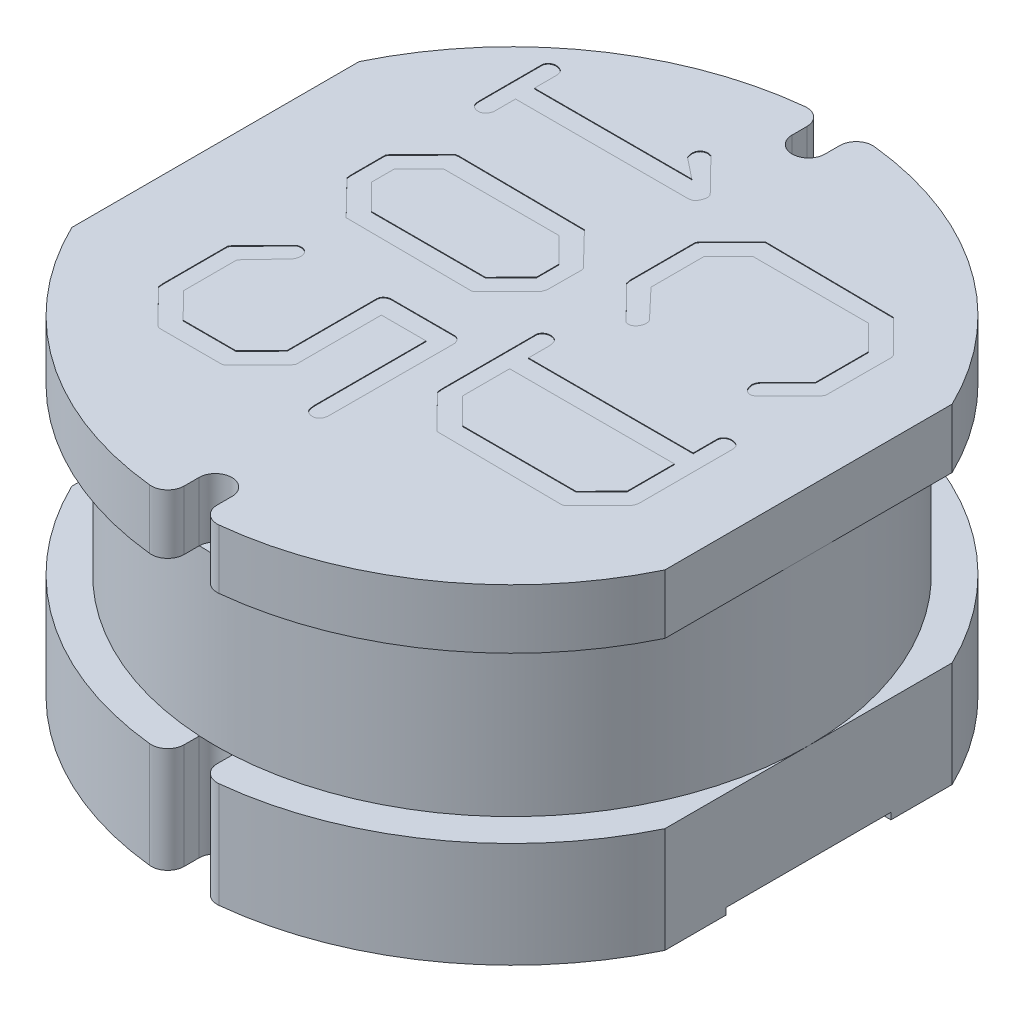
from build123d import *

# Parameters (mm, degrees)
BOSS_EXTRUDE1_DEPTH = 1.5
SKETCH2_R           = 4.5
BOSS_EXTRUDE2_DEPTH = 2.5
BOSS_EXTRUDE3_DEPTH = 0.9
BOSS_EXTRUDE4_START = 0.1
BOSS_EXTRUDE4_DEPTH = 0.1
CUT_EXTRUDE1_DEPTH  = 0.01


with BuildPart() as part:
    # Sketch1 → Boss-Extrude1 (new body)
    with BuildSketch(Plane(origin=(0, 0, 0), x_dir=(1, 0, 0), z_dir=(0, 1, 0))):
        with BuildLine():
            Line((-4.5, 2.179449472), (-4.5, -2.179449472))
            ThreePointArc((-4.5, -2.179449472), (-2.875040385, -4.09073866), (-0.526315789, -4.972222007))
            ThreePointArc((-0.526315789, -4.972222007), (-0.332785986, -4.909458892), (-0.25, -4.723610907))
            Line((-0.25, -4.723610907), (-0.25, -4.5))
            ThreePointArc((-0.25, -4.5), (0, -4.25), (0.25, -4.5))
            Line((0.25, -4.5), (0.25, -4.723610907))
            ThreePointArc((0.25, -4.723610907), (0.332785986, -4.909458892), (0.526315789, -4.972222007))
            ThreePointArc((0.526315789, -4.972222007), (2.875040385, -4.09073866), (4.5, -2.179449472))
            Line((4.5, -2.179449472), (4.5, 2.179449472))
            ThreePointArc((4.5, 2.179449472), (2.875040385, 4.09073866), (0.526315789, 4.972222007))
            ThreePointArc((0.526315789, 4.972222007), (0.332785986, 4.909458892), (0.25, 4.723610907))
            Line((0.25, 4.723610907), (0.25, 4.5))
            ThreePointArc((0.25, 4.5), (0, 4.25), (-0.25, 4.5))
            Line((-0.25, 4.5), (-0.25, 4.723610907))
            ThreePointArc((-0.25, 4.723610907), (-0.332785986, 4.909458892), (-0.526315789, 4.972222007))
            ThreePointArc((-0.526315789, 4.972222007), (-2.875040385, 4.09073866), (-4.5, 2.179449472))
        make_face()
    extrude(amount=BOSS_EXTRUDE1_DEPTH)

    # Sketch2 → Boss-Extrude2 (add)
    with BuildSketch(Plane(origin=(0, 1.5, 0), x_dir=(1, 0, 0), z_dir=(0, 1, 0))):
        with Locations(Location((0, 0, 0), (0, 0, 86.816491647))):
            Circle(SKETCH2_R)
    extrude(amount=BOSS_EXTRUDE2_DEPTH)

    # Sketch3 → Boss-Extrude3 (add)
    with BuildSketch(Plane(origin=(0, 4, 0), x_dir=(1, 0, 0), z_dir=(0, 1, 0))):
        with BuildLine():
            Line((-4.5, 2.179449472), (-4.5, -2.179449472))
            ThreePointArc((-4.5, -2.179449472), (-2.875040385, -4.09073866), (-0.526315789, -4.972222007))
            ThreePointArc((-0.526315789, -4.972222007), (-0.332785986, -4.909458892), (-0.25, -4.723610907))
            Line((-0.25, -4.723610907), (-0.25, -4.5))
            ThreePointArc((-0.25, -4.5), (0, -4.25), (0.25, -4.5))
            Line((0.25, -4.5), (0.25, -4.723610907))
            ThreePointArc((0.25, -4.723610907), (0.332785986, -4.909458892), (0.526315789, -4.972222007))
            ThreePointArc((0.526315789, -4.972222007), (2.875040385, -4.09073866), (4.5, -2.179449472))
            Line((4.5, -2.179449472), (4.5, 2.179449472))
            ThreePointArc((4.5, 2.179449472), (2.875040385, 4.09073866), (0.526315789, 4.972222007))
            ThreePointArc((0.526315789, 4.972222007), (0.332785986, 4.909458892), (0.25, 4.723610907))
            Line((0.25, 4.723610907), (0.25, 4.5))
            ThreePointArc((0.25, 4.5), (0, 4.25), (-0.25, 4.5))
            Line((-0.25, 4.5), (-0.25, 4.723610907))
            ThreePointArc((-0.25, 4.723610907), (-0.332785986, 4.909458892), (-0.526315789, 4.972222007))
            ThreePointArc((-0.526315789, 4.972222007), (-2.875040385, 4.09073866), (-4.5, 2.179449472))
        make_face()
    extrude(amount=BOSS_EXTRUDE3_DEPTH)

    # Sketch4 → Boss-Extrude4 (add)
    with BuildSketch(Plane.XZ.offset(BOSS_EXTRUDE4_START)):
        with BuildLine():
            Line((-4.5, 2.179449472), (-4.5, 1.25))
            Line((-4.5, 1.25), (4.5, 1.25))
            Line((4.5, 1.25), (4.5, 2.179449472))
            ThreePointArc((4.5, 2.179449472), (2.875040385, 4.09073866), (0.526315789, 4.972222007))
            ThreePointArc((0.526315789, 4.972222007), (0.332785986, 4.909458892), (0.25, 4.723610907))
            Line((0.25, 4.723610907), (0.25, 4.5))
            ThreePointArc((0.25, 4.5), (0, 4.25), (-0.25, 4.5))
            Line((-0.25, 4.5), (-0.25, 4.723610907))
            ThreePointArc((-0.25, 4.723610907), (-0.332785986, 4.909458892), (-0.526315789, 4.972222007))
            ThreePointArc((-0.526315789, 4.972222007), (-2.875040385, 4.09073866), (-4.5, 2.179449472))
        make_face()
        with BuildLine():
            Line((4.5, -1.25), (-4.5, -1.25))
            Line((-4.5, -1.25), (-4.5, -2.179449472))
            ThreePointArc((-4.5, -2.179449472), (-2.875040385, -4.09073866), (-0.526315789, -4.972222007))
            ThreePointArc((-0.526315789, -4.972222007), (-0.332785986, -4.909458892), (-0.25, -4.723610907))
            Line((-0.25, -4.723610907), (-0.25, -4.5))
            ThreePointArc((-0.25, -4.5), (0, -4.25), (0.25, -4.5))
            Line((0.25, -4.5), (0.25, -4.723610907))
            ThreePointArc((0.25, -4.723610907), (0.332785986, -4.909458892), (0.526315789, -4.972222007))
            ThreePointArc((0.526315789, -4.972222007), (2.875040385, -4.09073866), (4.5, -2.179449472))
            Line((4.5, -2.179449472), (4.5, -1.25))
        make_face()
    extrude(amount=-BOSS_EXTRUDE4_DEPTH)

    # Sketch6 → Cut-Extrude1 (cut)
    # profile 1 of 5: a face of its own
    with BuildSketch(Plane(origin=(0, 4.9, 0), x_dir=(1, 0, 0), z_dir=(0, 1, 0))):
        with BuildLine():
            Line((3.383928571, 1.272321429), (2.898995536, 0.791852679))
            add(Edge.make_bspline(
                [(2.898995536, 0.791852679), (2.888514153, 0.78545163), (2.871258821, 0.774913688), (2.851504845, 0.77104858), (2.84375, 0.76953125)],
                knots=[0, 0, 0, 0, 1.214857265, 2, 2, 2, 2], degree=3))
            add(Edge.make_bspline(
                [(2.84375, 0.76953125), (2.835284508, 0.770652848), (2.820551639, 0.772604815), (2.806681584, 0.777886917), (2.80078125, 0.780133929)],
                knots=[0, 0, 0, 0, 1.149198132, 2, 2, 2, 2], degree=3))
            add(Edge.make_bspline(
                [(2.80078125, 0.780133929), (2.790924001, 0.785429895), (2.770273529, 0.796524694), (2.748737055, 0.828434164), (2.732397969, 0.869235331), (2.727194865, 0.900665331), (2.724330357, 0.91796875)],
                knots=[0, 0, 0, 0, 0.804928788, 1.686287835, 2.726212839, 4, 4, 4, 4], degree=3))
            add(Edge.make_bspline(
                [(2.724330357, 0.91796875), (2.726022041, 0.927928799), (2.729246374, 0.946912559), (2.739344446, 0.972386231), (2.749866091, 0.995236009), (2.760480098, 1.007089236), (2.765625, 1.012834821)],
                knots=[0, 0, 0, 0, 1.150280358, 2.192423643, 3.123817944, 4, 4, 4, 4], degree=3))
            Line((2.765625, 1.012834821), (3.178571429, 1.430803571))
            Line((3.178571429, 1.430803571), (3.178571429, 2.229352679))
            Line((3.178571429, 2.229352679), (2.800223214, 2.607142857))
            Line((2.800223214, 2.607142857), (1.052455357, 2.607142857))
            Line((1.052455357, 2.607142857), (0.678571429, 2.229910714))
            Line((0.678571429, 2.229910714), (0.678571429, 1.430803571))
            Line((0.678571429, 1.430803571), (1.098772321, 0.987165179))
            add(Edge.make_bspline(
                [(1.098772321, 0.987165179), (1.104399509, 0.977553346), (1.115809958, 0.958063089), (1.117464822, 0.935528536), (1.118303571, 0.924107143)],
                knots=[0, 0, 0, 0, 0.986321751, 2, 2, 2, 2], degree=3))
            add(Edge.make_bspline(
                [(1.118303571, 0.924107143), (1.117960176, 0.91382715), (1.117295075, 0.893916435), (1.109607101, 0.865156823), (1.097200549, 0.838792972), (1.080625639, 0.814973645), (1.061127713, 0.795323186), (1.039739113, 0.780474656), (1.016664519, 0.771651881), (1.000627135, 0.770978336), (0.992745536, 0.770647321)],
                knots=[0, 0, 0, 0, 1.123847078, 2.176713554, 3.234303193, 4.302832359, 5.340400216, 6.250442534, 7.140177092, 8, 8, 8, 8], degree=3))
            Line((0.992745536, 0.770647321), (0.952008929, 0.779575893))
            Line((0.952008929, 0.779575893), (0.444196429, 1.294084821))
            Line((0.444196429, 1.294084821), (0.428571429, 1.359375))
            Line((0.428571429, 1.359375), (0.428571429, 2.356026786))
            Line((0.428571429, 2.356026786), (0.452566964, 2.392857143))
            Line((0.452566964, 2.392857143), (0.953125, 2.892857143))
            Line((0.953125, 2.892857143), (1.008928571, 2.892857143))
            Line((1.008928571, 2.892857143), (2.918526786, 2.872767857))
            Line((2.918526786, 2.872767857), (3.415736607, 2.369419643))
            Line((3.415736607, 2.369419643), (3.428571429, 2.330915179))
            Line((3.428571429, 2.330915179), (3.424665179, 1.328683036))
            Line((3.424665179, 1.328683036), (3.383928571, 1.272321429))
        make_face()
    # profile 2 of 5: a face of its own
    with BuildSketch(Plane(origin=(0, 4.9, 0), x_dir=(1, 0, 0), z_dir=(0, 1, 0))):
        with BuildLine():
            Line((3.377790179, -1.606584821), (2.890066964, -2.09765625))
            Line((2.890066964, -2.09765625), (2.849888393, -2.106026786))
            Line((2.849888393, -2.106026786), (0.948102679, -2.08984375))
            Line((0.948102679, -2.08984375), (0.435825893, -1.56640625))
            Line((0.435825893, -1.56640625), (0.428571429, -1.488839286))
            Line((0.428571429, -1.488839286), (0.428571429, -0.044642857))
            add(Edge.make_bspline(
                [(0.428571429, -0.044642857), (0.43452747, -0.032417302), (0.445944412, -0.008982535), (0.475170827, 0.017661126), (0.512169861, 0.033334688), (0.539273381, 0.034892491), (0.553571429, 0.035714286)],
                knots=[0, 0, 0, 0, 1.021395482, 1.95787967, 2.922710675, 4, 4, 4, 4], degree=3))
            add(Edge.make_bspline(
                [(0.553571429, 0.035714286), (0.562741579, 0.035371065), (0.580469571, 0.03470754), (0.605388228, 0.027193852), (0.627424261, 0.015199396), (0.646008845, -0.00179421), (0.661166972, -0.023999528), (0.671405341, -0.051725341), (0.677388065, -0.084753331), (0.678158625, -0.108416774), (0.678571429, -0.12109375)],
                knots=[0, 0, 0, 0, 0.962075719, 1.859911645, 2.709535321, 3.582282233, 4.48331142, 5.511760434, 6.667000706, 8, 8, 8, 8], degree=3))
            Line((0.678571429, -0.12109375), (0.678571429, -0.428571429))
            Line((0.678571429, -0.428571429), (3.178571429, -0.428571429))
            Line((3.178571429, -0.428571429), (3.178571429, -0.053571429))
            add(Edge.make_bspline(
                [(3.178571429, -0.053571429), (3.182418223, -0.041442513), (3.189847776, -0.018017184), (3.214251038, 0.00997385), (3.247024769, 0.028990726), (3.272241064, 0.033372876), (3.285714286, 0.035714286)],
                knots=[0, 0, 0, 0, 1.013349928, 1.957145876, 2.908490424, 4, 4, 4, 4], degree=3))
            add(Edge.make_bspline(
                [(3.285714286, 0.035714286), (3.295413488, 0.035427189), (3.314206698, 0.034870908), (3.340987229, 0.029646461), (3.365620931, 0.021975812), (3.387664873, 0.010441668), (3.406523229, -0.006351677), (3.420454379, -0.029686702), (3.42686022, -0.05957514), (3.427973465, -0.081081877), (3.428571429, -0.092633929)],
                knots=[0, 0, 0, 0, 1.05205527, 2.038466143, 2.951864688, 3.846535277, 4.718809578, 5.661009588, 6.743643115, 8, 8, 8, 8], degree=3))
            Line((3.428571429, -0.092633929), (3.428571429, -0.137276786))
            Line((3.428571429, -0.137276786), (3.428571429, -1.475446429))
            add(Edge.make_bspline(
                [(3.428571429, -1.475446429), (3.427969434, -1.489279219), (3.426830502, -1.515449874), (3.417329547, -1.551748326), (3.401611403, -1.583073377), (3.385709396, -1.598768589), (3.377790179, -1.606584821)],
                knots=[0, 0, 0, 0, 1.142777393, 2.162053479, 3.084700629, 4, 4, 4, 4], degree=3))
        make_face()
        Polygon((2.792410714, -1.821428571), (3.178571429, -1.431361607), (3.178571429, -0.714285714), (0.678571429, -0.714285714), (0.678571429, -1.431919643), (1.068080357, -1.821428571), align=None, mode=Mode.SUBTRACT)
    # profile 3 of 5: a face of its own
    with BuildSketch(Plane(origin=(0, 4.9, 0), x_dir=(1, 0, 0), z_dir=(0, 1, 0))):
        with BuildLine():
            Line((-0.151785714, 2.885044643), (-0.203683036, 2.875))
            Line((-0.203683036, 2.875), (-2.821428571, 2.875))
            Line((-2.821428571, 2.875), (-2.821428571, 2.535714286))
            add(Edge.make_bspline(
                [(-2.821428571, 2.535714286), (-2.827521971, 2.521076352), (-2.838834267, 2.493901269), (-2.863633501, 2.460098684), (-2.894322522, 2.437126555), (-2.917665497, 2.431389133), (-2.929129464, 2.428571429)],
                knots=[0, 0, 0, 0, 1.189008233, 2.207374185, 3.119623671, 4, 4, 4, 4], degree=3))
            add(Edge.make_bspline(
                [(-2.929129464, 2.428571429), (-2.946019282, 2.429897037), (-2.980059151, 2.432568678), (-3.020879991, 2.449945031), (-3.048366807, 2.475689104), (-3.062362413, 2.506338406), (-3.070242274, 2.545903905), (-3.071006445, 2.575286813), (-3.071428571, 2.591517857)],
                knots=[0, 0, 0, 0, 1.216892479, 2.452534526, 3.106512186, 3.885698948, 4.832065435, 6, 6, 6, 6], degree=3))
            Line((-3.071428571, 2.591517857), (-3.071428571, 3.540736607))
            add(Edge.make_bspline(
                [(-3.071428571, 3.540736607), (-3.066662291, 3.552070645), (-3.05748244, 3.573899986), (-3.033424728, 3.600429498), (-3.001811813, 3.617544361), (-2.978240256, 3.622446209), (-2.965959821, 3.625)],
                knots=[0, 0, 0, 0, 1.028909836, 1.981678895, 2.948484413, 4, 4, 4, 4], degree=3))
            add(Edge.make_bspline(
                [(-2.965959821, 3.625), (-2.955528513, 3.6244854), (-2.935440966, 3.623494436), (-2.906755105, 3.618392721), (-2.881697852, 3.607977944), (-2.859575362, 3.593981607), (-2.84112815, 3.573402603), (-2.829270353, 3.544692108), (-2.82226303, 3.508901636), (-2.821722986, 3.482555212), (-2.821428571, 3.468191964)],
                knots=[0, 0, 0, 0, 1.013777329, 1.952228677, 2.810656312, 3.632009062, 4.476265827, 5.446155599, 6.607723798, 8, 8, 8, 8], degree=3))
            Line((-2.821428571, 3.468191964), (-2.821428571, 3.160714286))
            Line((-2.821428571, 3.160714286), (-0.432477679, 3.160714286))
            Line((-0.432477679, 3.160714286), (-0.752790179, 3.415178571))
            add(Edge.make_bspline(
                [(-0.752790179, 3.415178571), (-0.755378146, 3.425039713), (-0.760107295, 3.443059577), (-0.766780867, 3.467610461), (-0.770085191, 3.487838453), (-0.771254234, 3.499808819), (-0.771763393, 3.505022321)],
                knots=[0, 0, 0, 0, 1.330298006, 2.430934346, 3.316618377, 4, 4, 4, 4], degree=3))
            add(Edge.make_bspline(
                [(-0.771763393, 3.505022321), (-0.771244217, 3.513041408), (-0.770229362, 3.528716636), (-0.764923897, 3.55151739), (-0.754261842, 3.571786267), (-0.740989506, 3.590626286), (-0.723066259, 3.606754835), (-0.69995572, 3.616876357), (-0.673607409, 3.624049052), (-0.654634312, 3.624669575), (-0.64453125, 3.625)],
                knots=[0, 0, 0, 0, 0.976052942, 1.907929565, 2.817615467, 3.739849352, 4.700870998, 5.701729663, 6.776184527, 8, 8, 8, 8], degree=3))
            Line((-0.64453125, 3.625), (-0.595424107, 3.613839286))
            Line((-0.595424107, 3.613839286), (-0.092075893, 3.099888393))
            add(Edge.make_bspline(
                [(-0.092075893, 3.099888393), (-0.085989435, 3.089931503), (-0.07323618, 3.069068342), (-0.072049113, 3.044599294), (-0.071428571, 3.031808036)],
                knots=[0, 0, 0, 0, 0.954494819, 2, 2, 2, 2], degree=3))
            add(Edge.make_bspline(
                [(-0.071428571, 3.031808036), (-0.072654702, 3.020537263), (-0.075600533, 2.99345874), (-0.089653469, 2.960408145), (-0.102605564, 2.930834694), (-0.117167711, 2.912016686), (-0.132475863, 2.89533309), (-0.145404792, 2.88844445), (-0.151785714, 2.885044643)],
                knots=[0, 0, 0, 0, 1.167612732, 2.805240475, 3.683154432, 4.495326171, 5.257385778, 6, 6, 6, 6], degree=3))
        make_face()
    # profile 4 of 5: a face of its own
    with BuildSketch(Plane(origin=(0, 4.9, 0), x_dir=(1, 0, 0), z_dir=(0, 1, 0))):
        Polygon((-0.099330357, 0.538504464), (-0.604352679, 0.029017857), (-0.637834821, 0.017857143), (-2.546875, 0.030133929), (-3.063058036, 0.55859375), (-3.071428571, 0.622209821), (-3.071428571, 1.150111607), (-3.047433036, 1.188058036), (-2.547991071, 1.69140625), (-2.49609375, 1.696428571), (-0.581473214, 1.680245536), (-0.083705357, 1.166852679), (-0.071428571, 1.126674107), (-0.075334821, 0.60546875), align=None)
        Polygon((-0.707589286, 0.303571429), (-0.321428571, 0.693638393), (-0.321428571, 1.031808036), (-0.696428571, 1.410714286), (-2.446986607, 1.410714286), (-2.821428571, 1.032366071), (-2.821428571, 0.693080357), (-2.431919643, 0.303571429), align=None, mode=Mode.SUBTRACT)
    # profile 5 of 5: a face of its own
    with BuildSketch(Plane(origin=(0, 4.9, 0), x_dir=(1, 0, 0), z_dir=(0, 1, 0))):
        with BuildLine():
            add(Edge.make_bspline(
                [(-0.076450893, -2.721540179), (-0.080006714, -2.737501498), (-0.086578364, -2.767000232), (-0.109033509, -2.803838562), (-0.139747215, -2.830000656), (-0.164738026, -2.83578443), (-0.177455357, -2.838727679)],
                knots=[0, 0, 0, 0, 1.174371758, 2.170402149, 3.068953704, 4, 4, 4, 4], degree=3))
            add(Edge.make_bspline(
                [(-0.177455357, -2.838727679), (-0.187161784, -2.838514082), (-0.206044991, -2.838098545), (-0.233054647, -2.831781936), (-0.257700486, -2.821370263), (-0.281153989, -2.80709589), (-0.300898421, -2.782933899), (-0.312586082, -2.747846389), (-0.320188081, -2.703093107), (-0.320987018, -2.669689189), (-0.321428571, -2.651227679)],
                knots=[0, 0, 0, 0, 0.848445739, 1.65059474, 2.409922083, 3.187037106, 4.031721707, 5.078420244, 6.385315948, 8, 8, 8, 8], degree=3))
            Line((-0.321428571, -2.651227679), (-0.321428571, -0.982142857))
            Line((-0.321428571, -0.982142857), (-1, -0.982142857))
            Line((-1, -0.982142857), (-1, -2.272321429))
            Line((-1, -2.272321429), (-1.034040179, -2.33203125))
            Line((-1.034040179, -2.33203125), (-1.534040179, -2.829799107))
            Line((-1.534040179, -2.829799107), (-1.578125, -2.839285714))
            Line((-1.578125, -2.839285714), (-2.516741071, -2.839285714))
            Line((-2.516741071, -2.839285714), (-2.553571429, -2.820870536))
            Line((-2.553571429, -2.820870536), (-3.064174107, -2.298549107))
            Line((-3.064174107, -2.298549107), (-3.071428571, -2.220982143))
            Line((-3.071428571, -2.220982143), (-3.071428571, -1.241071429))
            Line((-3.071428571, -1.241071429), (-3.047433036, -1.204799107))
            Line((-3.047433036, -1.204799107), (-2.557477679, -0.706473214))
            add(Edge.make_bspline(
                [(-2.557477679, -0.706473214), (-2.548615993, -0.703680627), (-2.529735489, -0.697730805), (-2.509944125, -0.69688003), (-2.499441964, -0.696428571)],
                knots=[0, 0, 0, 0, 0.938712796, 2, 2, 2, 2], degree=3))
            add(Edge.make_bspline(
                [(-2.499441964, -0.696428571), (-2.49138525, -0.696831238), (-2.477174882, -0.697541457), (-2.463507713, -0.70143775), (-2.457589286, -0.703125)],
                knots=[0, 0, 0, 0, 1.133920638, 2, 2, 2, 2], degree=3))
            add(Edge.make_bspline(
                [(-2.457589286, -0.703125), (-2.447545807, -0.708359135), (-2.427880112, -0.718607866), (-2.404752505, -0.743192762), (-2.389198735, -0.774286741), (-2.384658516, -0.79744663), (-2.382254464, -0.809709821)],
                knots=[0, 0, 0, 0, 0.988554768, 1.935645833, 2.906921838, 4, 4, 4, 4], degree=3))
            add(Edge.make_bspline(
                [(-2.382254464, -0.809709821), (-2.382564296, -0.823011446), (-2.383159344, -0.848557893), (-2.394058307, -0.884357267), (-2.409660488, -0.91691175), (-2.426361444, -0.933614841), (-2.434709821, -0.941964286)],
                knots=[0, 0, 0, 0, 1.083378971, 2.08068456, 3.040583703, 4, 4, 4, 4], degree=3))
            Line((-2.434709821, -0.941964286), (-2.821428571, -1.351004464))
            Line((-2.821428571, -1.351004464), (-2.821428571, -2.161830357))
            Line((-2.821428571, -2.161830357), (-2.436941964, -2.553571429))
            Line((-2.436941964, -2.553571429), (-1.635044643, -2.553571429))
            Line((-1.635044643, -2.553571429), (-1.25, -2.161830357))
            Line((-1.25, -2.161830357), (-1.25, -0.797991071))
            add(Edge.make_bspline(
                [(-1.25, -0.797991071), (-1.248564422, -0.788126422), (-1.245775129, -0.768959646), (-1.231087208, -0.743240978), (-1.210107303, -0.721421708), (-1.191929752, -0.711587083), (-1.182477679, -0.706473214)],
                knots=[0, 0, 0, 0, 0.994574724, 1.932434716, 2.924894821, 4, 4, 4, 4], degree=3))
            Line((-1.182477679, -0.706473214), (-1.147321429, -0.696428571))
            Line((-1.147321429, -0.696428571), (-0.157924107, -0.696428571))
            add(Edge.make_bspline(
                [(-0.157924107, -0.696428571), (-0.147904124, -0.700305069), (-0.12784432, -0.708065738), (-0.103277904, -0.731000276), (-0.083117442, -0.760601604), (-0.075475764, -0.78431558), (-0.071428571, -0.796875)],
                knots=[0, 0, 0, 0, 0.92405125, 1.849931888, 2.861278796, 4, 4, 4, 4], degree=3))
            Line((-0.071428571, -0.796875), (-0.076450893, -2.721540179))
        make_face()
    extrude(amount=-CUT_EXTRUDE1_DEPTH, mode=Mode.SUBTRACT)


solid = part.part
